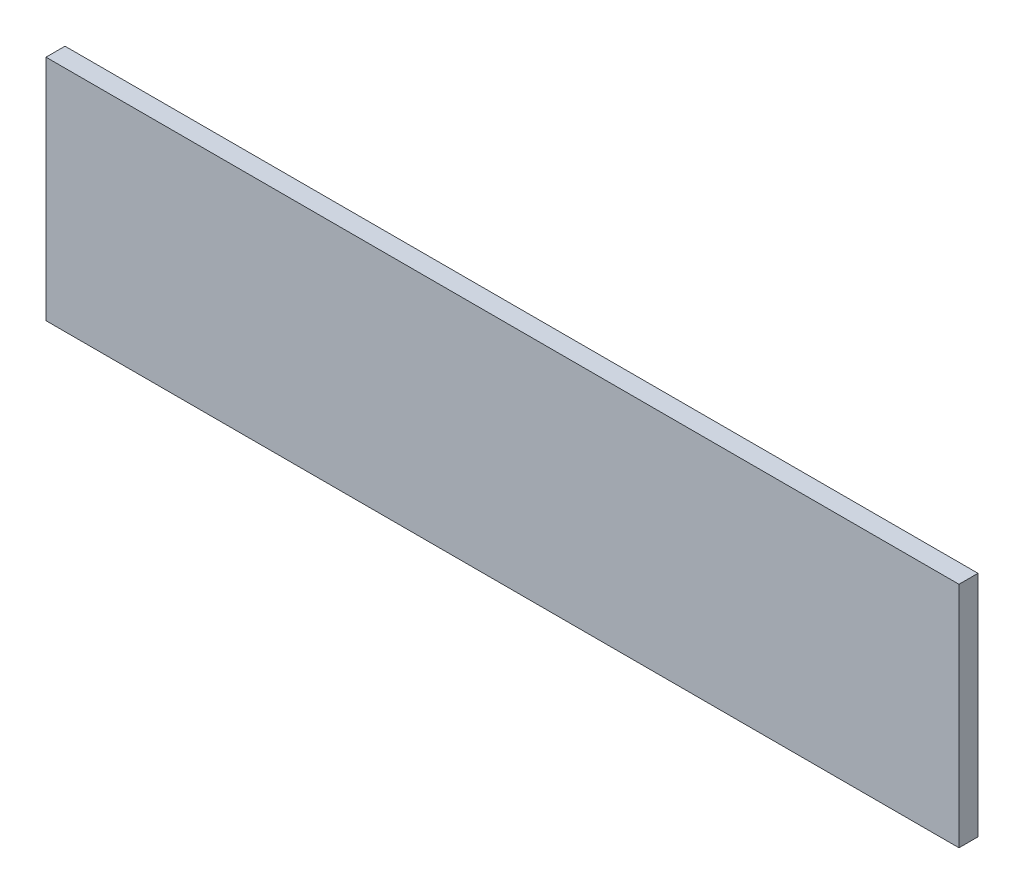
from build123d import *

# Parameters (mm, degrees)
BOSS_EXTRUDE1_DEPTH      = 25.4
BOSS_EXTRUDE1_DEPTH_BACK = 25.4
SKETCH3_W                = 2438.4
SKETCH3_H                = 609.6


with BuildPart() as part:
    # Sketch3 → Boss-Extrude1 (new, two sides: drawn at the far end of the back side and taken through both)
    with BuildSketch(Plane.XY.offset(-BOSS_EXTRUDE1_DEPTH_BACK)):
        Rectangle(SKETCH3_W, SKETCH3_H)
    extrude(amount=BOSS_EXTRUDE1_DEPTH + BOSS_EXTRUDE1_DEPTH_BACK)


solid = part.part
